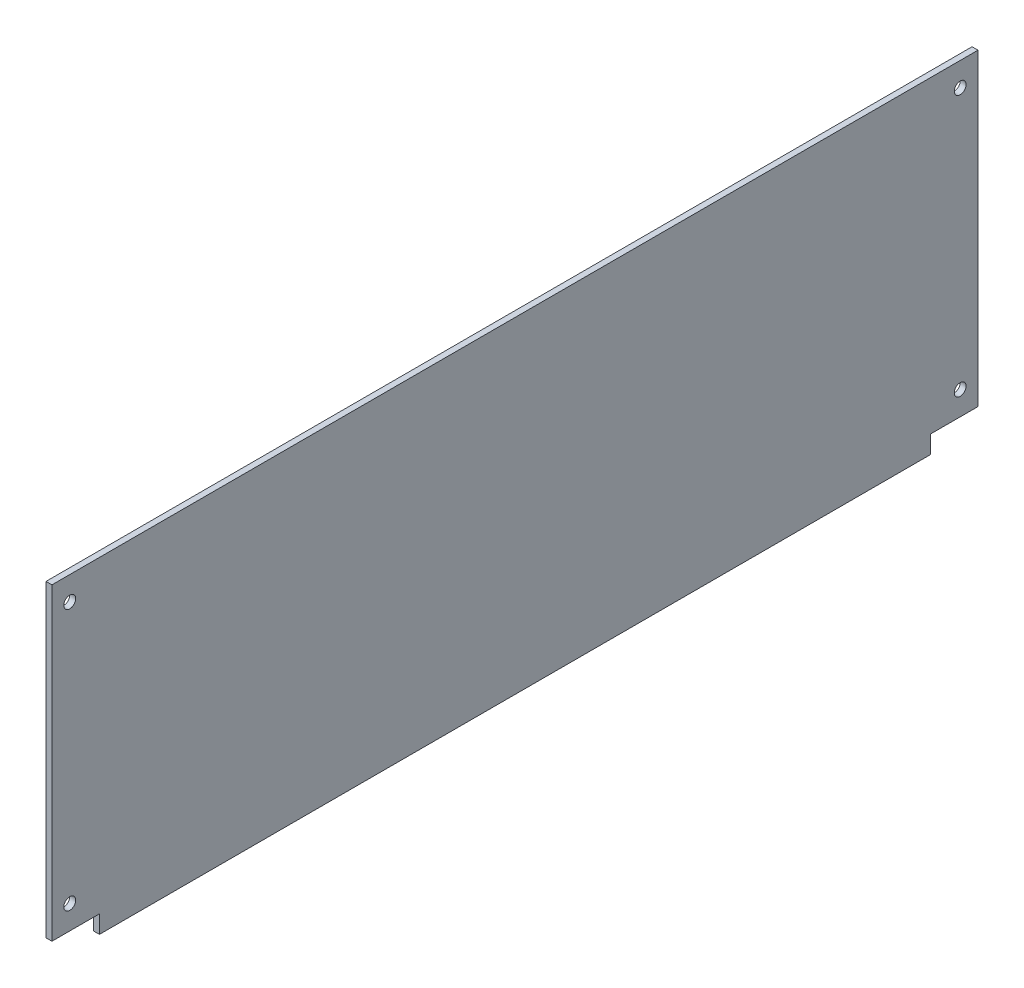
from build123d import *

# Parameters (mm, degrees)
SKETCH1_W           = 5
SKETCH1_H           = 275
BOSS_EXTRUDE1_DEPTH = 700
SKETCH2_W           = 5
SKETCH2_H           = 40
BOSS_EXTRUDE2_DEPTH = 260
SKETCH3_R           = 5
CUT_EXTRUDE1_DEPTH  = 790.461842016


with BuildPart() as part:
    # Sketch1 → Boss-Extrude1 (new body)
    with BuildSketch(Plane.XY):
        with Locations((2.5, 137.5)):
            Rectangle(SKETCH1_W, SKETCH1_H)
    extrude(amount=BOSS_EXTRUDE1_DEPTH)

    # Sketch2 → Boss-Extrude2 (add)
    with BuildSketch(Plane(origin=(0, 15, 0), x_dir=(-1, 0, 0), z_dir=(0, -1, 0))):
        with Locations((-2.5, 20)):
            Rectangle(SKETCH2_W, SKETCH2_H)
    boss_extrude2 = extrude(amount=-BOSS_EXTRUDE2_DEPTH)

    # Mirror1: Boss-Extrude2 across plane
    add(boss_extrude2.mirror(Plane(origin=(0, 0, 350), x_dir=(1, 0, 0), z_dir=(0, 0, -1))))

    # Sketch3 → Cut-Extrude1 (cut, through all)
    with BuildSketch(Plane.ZY):
        with Locations((-25, 255)):
            Circle(SKETCH3_R)
        with Locations((-25, 35)):
            Circle(SKETCH3_R)
    cut_extrude1 = extrude(amount=-CUT_EXTRUDE1_DEPTH, mode=Mode.SUBTRACT)

    # Mirror2: Cut-Extrude1 across plane
    add(cut_extrude1.mirror(Plane(origin=(0, 0, 350), x_dir=(1, 0, 0), z_dir=(0, 0, -1))), mode=Mode.SUBTRACT)


solid = part.part
